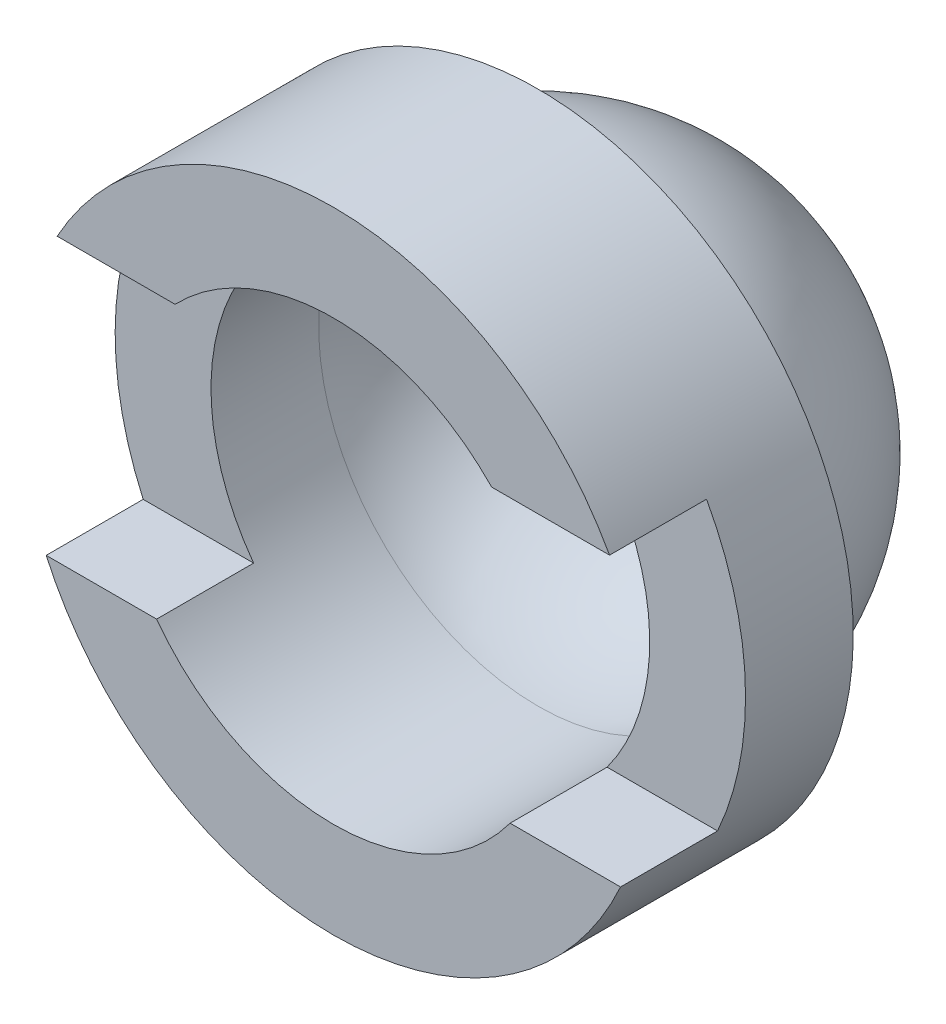
from build123d import *

# Parameters (mm, degrees)
ESBO_O2_W             = 15.991560494
ESBO_O2_H             = 5.81194908
CORTE_EXTRUS_O1_DEPTH = 2


with BuildPart() as part:
    # Esboço1 → Revolução1 (revolve)
    with BuildSketch(Plane(origin=(0, 0, 0), x_dir=(0, 0, -1), z_dir=(1, 0, 0))):
        with BuildLine():
            Line((4.220409826, 6.5), (0, 6.5))
            Line((0, 6.5), (0, 5.93167583))
            Line((0, 5.93167583), (0, 4.523660393))
            Line((0, 4.523660393), (3.444296294, 4.523660393))
            Line((3.444296294, 4.523660393), (4.220409826, 4.523660393))
            ThreePointArc((4.220409826, 4.523660393), (7.419120765, 3.198710939), (8.744070218, 0))
            Line((8.744070218, 0), (9.5, 0))
            ThreePointArc((9.5, 0), (7.95364384, 3.733234014), (4.220409826, 5.279590174))
            Line((4.220409826, 5.279590174), (4.220409826, 6.5))
        make_face()
    revolve(axis=Axis((0, 0, 0), (0, 0, -1)))

    # Esboço2 → Corte-extrusão1 (cut)
    with BuildSketch(Plane.XY):
        with Locations((0.060903658, 0.226213587)):
            Rectangle(ESBO_O2_W, ESBO_O2_H)
    extrude(amount=-CORTE_EXTRUS_O1_DEPTH, mode=Mode.SUBTRACT)


solid = part.part
